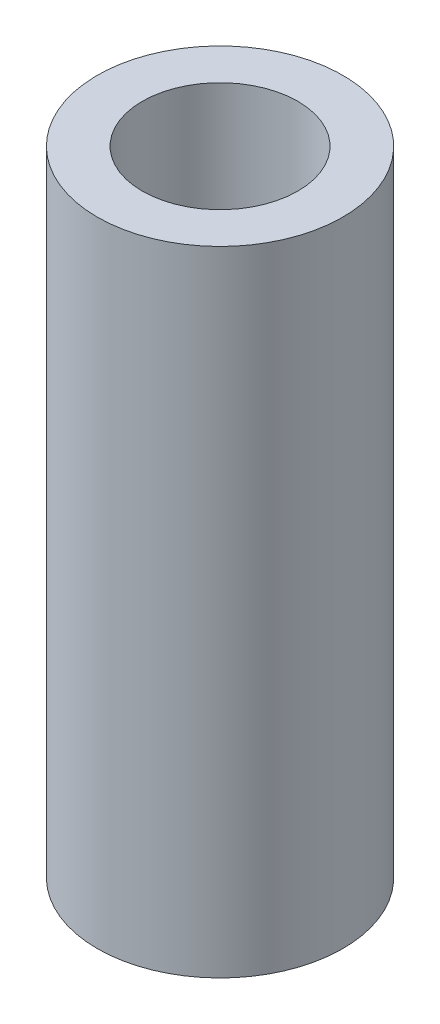
from build123d import *

# Parameters (mm, degrees)
SKETCH1_R           = 12.415
BOSS_EXTRUDE1_DEPTH = 64.05
SKETCH2_R           = 7.865
CUT_EXTRUDE1_DEPTH  = 64.05


with BuildPart() as part:
    # Sketch1 → Boss-Extrude1 (new body)
    with BuildSketch(Plane(origin=(0, 0, 0), x_dir=(1, 0, 0), z_dir=(0, 1, 0))):
        with Locations(Location((0, 0, 0), (0, 0, 270))):
            Circle(SKETCH1_R)
    extrude(amount=BOSS_EXTRUDE1_DEPTH)

    # Sketch2 → Cut-Extrude1 (cut)
    with BuildSketch(Plane(origin=(0, 64.05, 0), x_dir=(1, 0, 0), z_dir=(0, 1, 0))):
        with Locations(Location((0, 0, 0), (0, 0, 270))):
            Circle(SKETCH2_R)
    extrude(amount=-CUT_EXTRUDE1_DEPTH, mode=Mode.SUBTRACT)


solid = part.part
